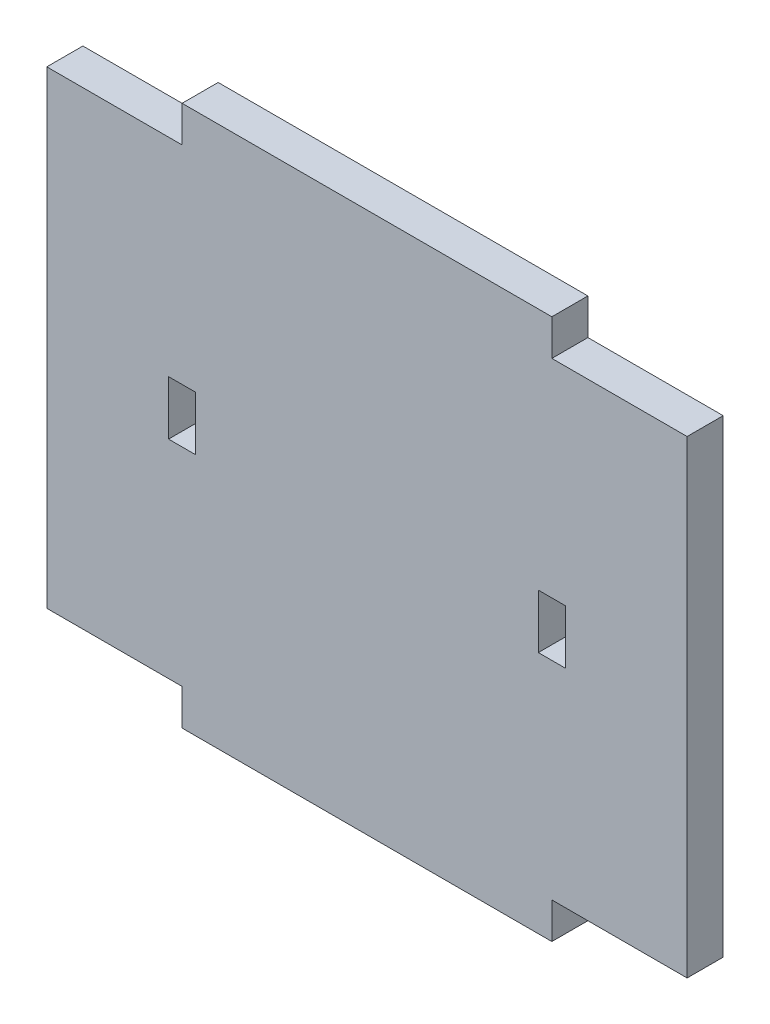
from build123d import *

# Parameters (mm, degrees)
BOSS_EXTRUDE1_DEPTH = 4
SKETCH2_W           = 3
SKETCH2_H           = 6
CUT_EXTRUDE1_DEPTH  = 10


with BuildPart() as part:
    # Sketch1 → Boss-Extrude1 (new body)
    with BuildSketch(Plane.XY):
        Polygon((-13.263157895, 0), (27.736842105, 0), (27.736842105, 4), (42.736842105, 4), (42.736842105, 56), (27.736842105, 56), (27.736842105, 60), (-13.263157895, 60), (-13.263157895, 56), (-28.263157895, 56), (-28.263157895, 4), (-13.263157895, 4), align=None)
    extrude(amount=BOSS_EXTRUDE1_DEPTH)

    # Sketch2 → Cut-Extrude1 (cut)
    with BuildSketch(Plane.XY.offset(4)):
        with Locations((-13.263157895, 30)):
            Rectangle(SKETCH2_W, SKETCH2_H)
        with Locations((27.736842105, 30)):
            Rectangle(SKETCH2_W, SKETCH2_H)
    extrude(amount=-CUT_EXTRUDE1_DEPTH, mode=Mode.SUBTRACT)


solid = part.part
